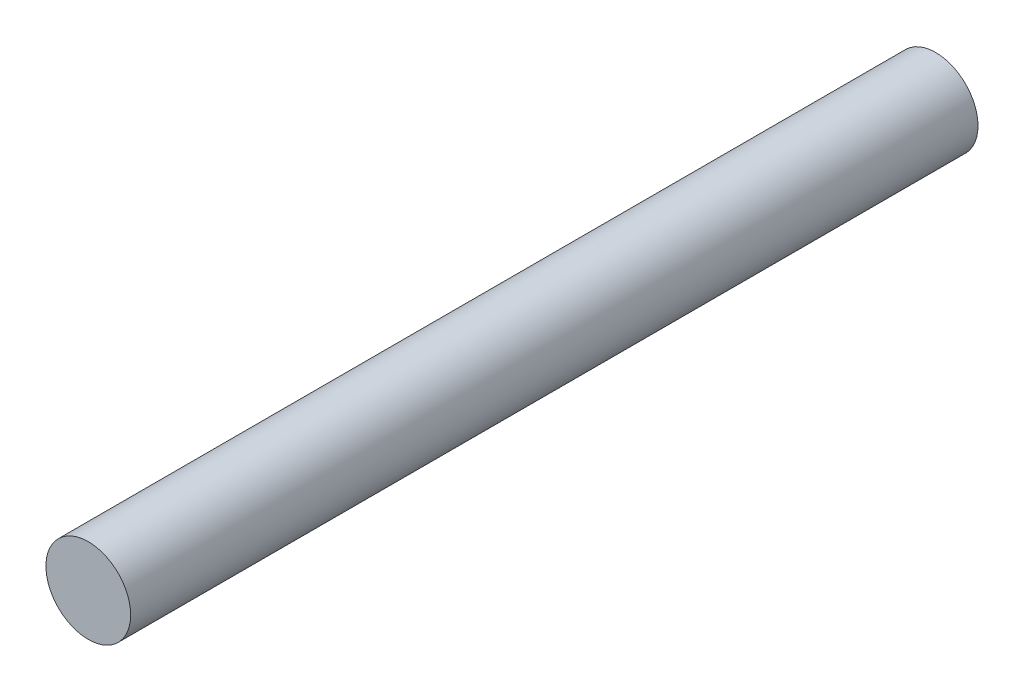
from build123d import *

# Parameters (mm, degrees)
PIN_PROFILE_R     = 0.5
PIN_EXTRUDE_DEPTH = 10


with BuildPart() as part:
    # Pin Profile → Pin Extrude (new body)
    with BuildSketch(Plane.XY):
        Circle(PIN_PROFILE_R)
    extrude(amount=PIN_EXTRUDE_DEPTH)


solid = part.part
